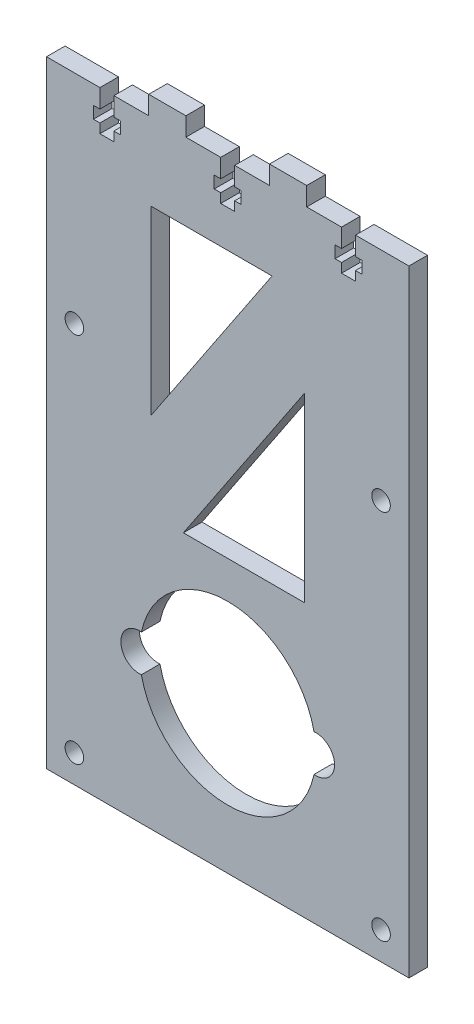
from build123d import *

# Parameters (mm, degrees)
EXTRUDE_1_DEPTH     = 4
SKETCH_3_R          = 2
CUT_EXTRUDE_1_DEPTH = 10
CUT_EXTRUDE_2_DEPTH = 10


with BuildPart() as part:
    # 草图1 → 凸台-拉伸1 (new body)
    with BuildSketch(Plane.XY):
        Polygon((1.5, 0), (1.5, -4), (2.9, -4), (2.9, -6.6), (1.5, -6.6), (1.5, -8.6), (-1.5, -8.6), (-1.5, -6.6), (-2.9, -6.6), (-2.9, -4), (-1.5, -4), (-1.5, 0), (-9, 0), (-9, 4), (-17, 4), (-17, 0), (-24.5, 0), (-24.5, -4), (-23.1, -4), (-23.1, -6.6), (-24.5, -6.6), (-24.5, -8.6), (-27.5, -8.6), (-27.5, -6.6), (-28.9, -6.6), (-28.9, -4), (-27.5, -4), (-27.5, 0), (-39, 0), (-39, -132.712721559), (39, -132.712721559), (39, 0), (27.5, 0), (27.5, -4), (28.9, -4), (28.9, -6.6), (27.5, -6.6), (27.5, -8.6), (24.5, -8.6), (24.5, -6.6), (23.1, -6.6), (23.1, -4), (24.5, -4), (24.5, 0), (17, 0), (17, 4), (9, 4), (9, 0), align=None)
        with BuildLine():
            ThreePointArc((18.578947368, -97.022222394), (0, -82), (-18.578947368, -97.022222394))
            ThreePointArc((-18.578947368, -97.022222394), (-23, -101), (-18.578947368, -104.977777606))
            ThreePointArc((-18.578947368, -104.977777606), (0, -120), (18.578947368, -104.977777606))
            ThreePointArc((18.578947368, -104.977777606), (23, -101), (18.578947368, -97.022222394))
        make_face(mode=Mode.SUBTRACT)
    extrude(amount=EXTRUDE_1_DEPTH)

    # 草图3 → 切除-拉伸1 (cut)
    with BuildSketch(Plane(origin=(0, 0, 0), x_dir=(-1, 0, 0), z_dir=(0, 0, -1))):
        with Locations((33, -126.712721559)):
            Circle(SKETCH_3_R)
        with Locations((33, -46.712721559)):
            Circle(SKETCH_3_R)
        with Locations((-33, -46.712721559)):
            Circle(SKETCH_3_R)
        with Locations((-33, -126.712721559)):
            Circle(SKETCH_3_R)
    extrude(amount=-CUT_EXTRUDE_1_DEPTH, mode=Mode.SUBTRACT)

    # 草图4 → 切除-拉伸2 (cut)
    with BuildSketch(Plane(origin=(0, 0, 0), x_dir=(-1, 0, 0), z_dir=(0, 0, -1))):
        Polygon((16.5, -16.6), (16.5, -55.607703077), (-9.540564725, -16.6), align=None)
        Polygon((9.540564725, -74), (-16.5, -34.992296923), (-16.5, -74), align=None)
    extrude(amount=-CUT_EXTRUDE_2_DEPTH, mode=Mode.SUBTRACT)


solid = part.part
